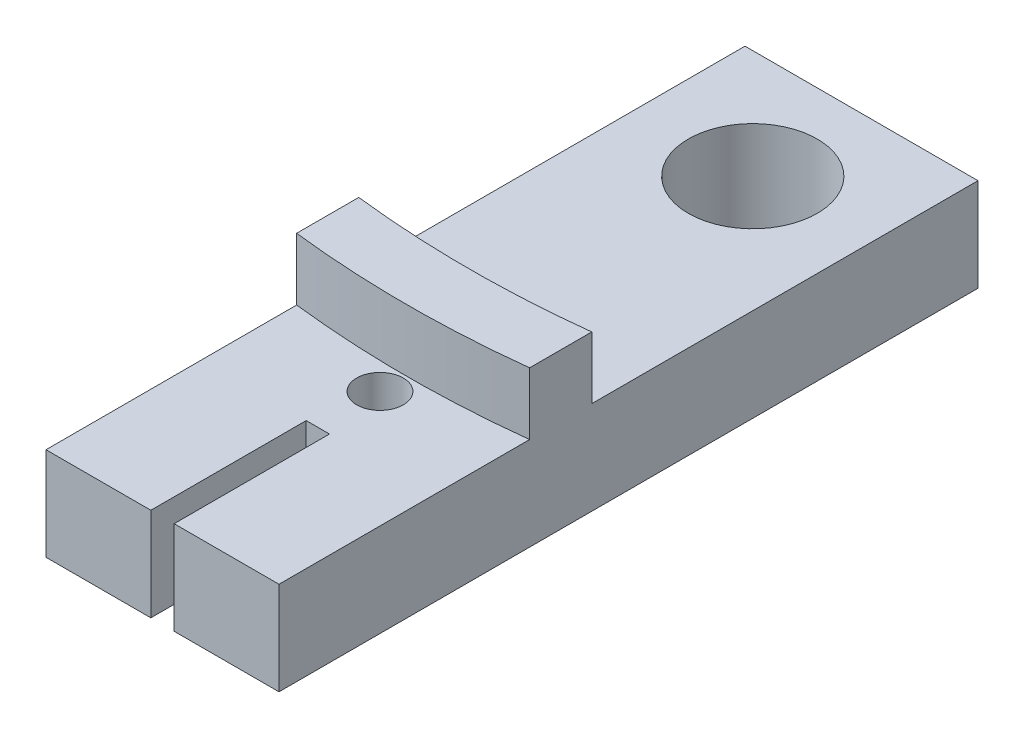
from build123d import *

# Parameters (mm, degrees)
SKETCH1_W           = 15
SKETCH1_H           = 35
SKETCH1_R           = 4.15
SKETCH1_R_2         = 1.5
BOSS_EXTRUDE1_DEPTH = 6
BOSS_EXTRUDE2_DEPTH = 4
SKETCH3_W           = 6.75
SKETCH3_H           = 6
BOSS_EXTRUDE3_DEPTH = 10


with BuildPart() as part:
    # Sketch1 → Boss-Extrude1 (new body)
    with BuildSketch(Plane(origin=(0, 0, 0), x_dir=(1, 0, 0), z_dir=(0, 1, 0))):
        Rectangle(SKETCH1_W, SKETCH1_H)
        with Locations(Location((0, 10.5, 0), (0, 0, 270))):
            Circle(SKETCH1_R, mode=Mode.SUBTRACT)
        with Locations(Location((0, -13.5, 0), (0, 0, 270))):
            Circle(SKETCH1_R_2, mode=Mode.SUBTRACT)
    extrude(amount=BOSS_EXTRUDE1_DEPTH)

    # Sketch2 → Boss-Extrude2 (add)
    with BuildSketch(Plane(origin=(0, 6, 0), x_dir=(1, 0, 0), z_dir=(0, 1, 0))):
        with BuildLine():
            Line((-7.5, -11.365857851), (-7.5, -7.365857851))
            ThreePointArc((-7.5, -7.365857851), (0, -7.8), (7.5, -7.365857851))
            Line((7.5, -7.365857851), (7.5, -11.365857851))
            ThreePointArc((7.5, -11.365857851), (0, -11.8), (-7.5, -11.365857851))
        make_face()
    extrude(amount=BOSS_EXTRUDE2_DEPTH)

    # Sketch3 → Boss-Extrude3 (add)
    with BuildSketch(Plane.XY.offset(17.5)):
        with Locations((4.125, 3)):
            Rectangle(SKETCH3_W, SKETCH3_H)
        with Locations((-4.125, 3)):
            Rectangle(SKETCH3_W, SKETCH3_H)
    extrude(amount=BOSS_EXTRUDE3_DEPTH)


solid = part.part
